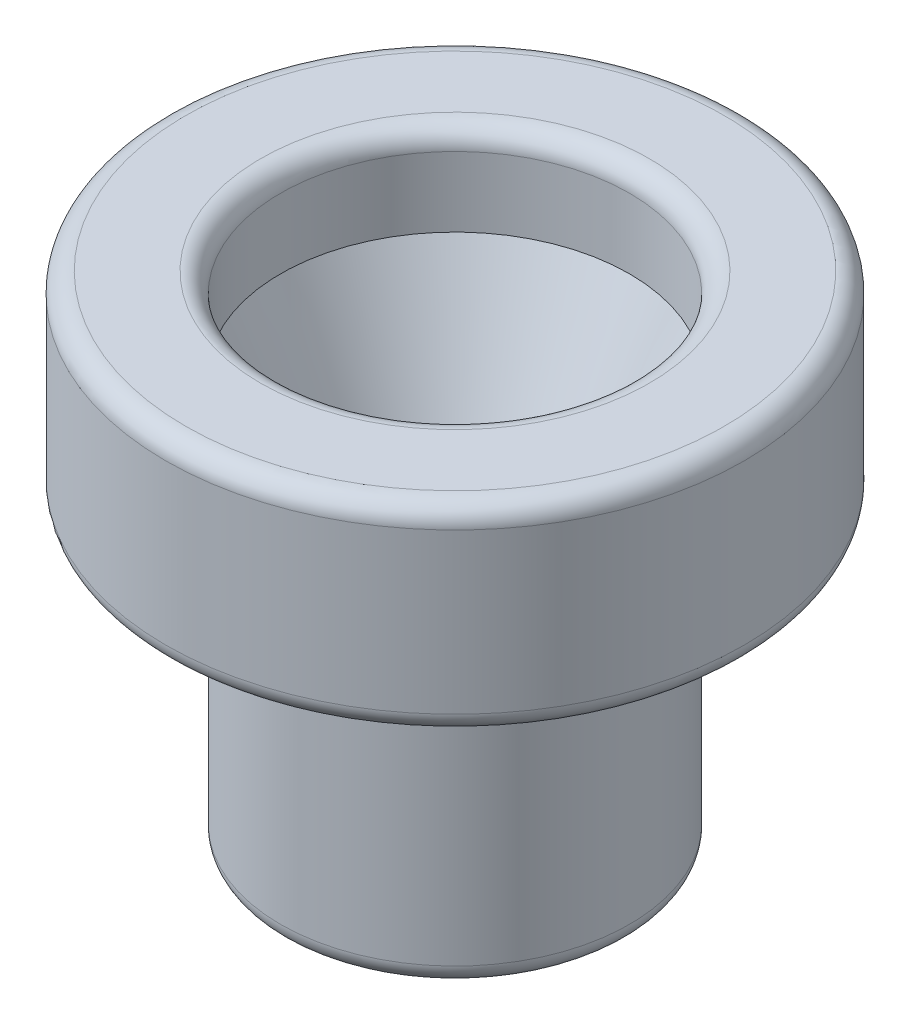
from build123d import *

# Parameters (mm, degrees)
FILLET1_R = 2.54


with BuildPart() as part:
    # Sketch1 → Revolve2 (revolve)
    with BuildSketch(Plane.XY, mode=Mode.PRIVATE) as revolve2_sk:
        Polygon((13.335, 0), (13.335, 33.02), (22.225, 52.07), (22.225, 63.5), (36.83, 63.5), (36.83, 38.1), (22.225, 38.1), (22.225, 0), align=None)
    revolve(revolve2_sk.sketch.rotate(Axis((0, 0, 0), (0, 1, 0)), 90), axis=Axis((0, 0, 0), (0, 1, 0)))

    # Fillet1
    fillet1_edges = [part.edges().sort_by_distance(p)[0] for p in [
        (0, 0, 22.225),
        (0, 33.02, 13.335),
        (0, 63.5, 22.225),
        (0, 63.5, 36.83),
        (0, 38.1, 36.83),
    ]]
    fillet(fillet1_edges, radius=FILLET1_R)


solid = part.part
